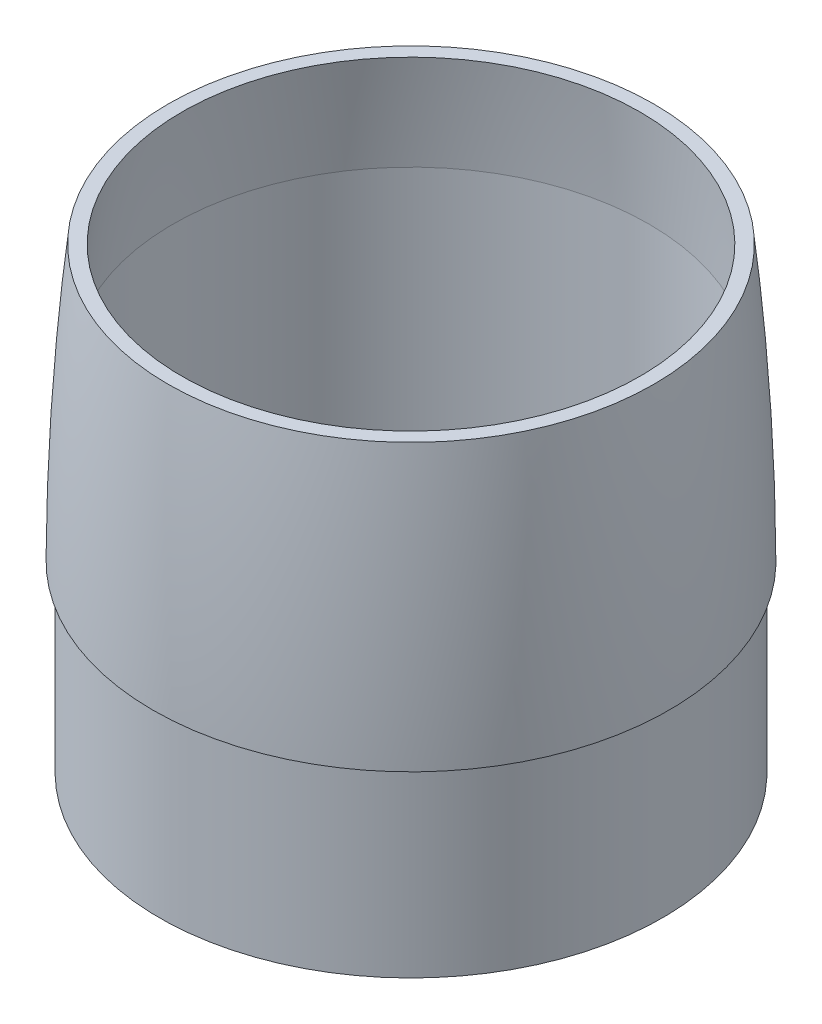
from build123d import *

# Parameters (mm, degrees)
CORTAR_EXTRUIR1_DEPTH      = 301.768881503
CORTAR_EXTRUIR1_DEPTH_BACK = 301.768881503
CROQUIS2_W                 = 123.052160051
CROQUIS2_H                 = 221.260981795


with BuildPart() as part:
    # Croquis1 → Revolución1 (revolve)
    with BuildSketch(Plane(origin=(0, 0, 0), x_dir=(0, 0, -1), z_dir=(1, 0, 0))):
        with BuildLine():
            Line((52, 10), (52, 77.802029213))
            ThreePointArc((52, 77.802029213), (35.222542715, 182.66683475), (0, 282.854074446))
            Line((0, 282.854074446), (0, 290))
            ThreePointArc((0, 290), (41.804081284, 168.069080738), (56.4, 40))
            Line((56.4, 40), (55, 40))
            Line((55, 40), (55, 0))
            Line((55, 0), (52, 0))
            Line((52, 0), (0, 0))
            Line((0, 0), (0, 10))
            Line((0, 10), (52, 10))
        make_face()
    revolve(axis=Axis((0, 0, 0), (0, 1, 0)))

    # Croquis2 → Cortar-Extruir1 (cut, two sides: drawn at the far end of the back side and taken through both)
    with BuildSketch(Plane(origin=(0, 0, 0), x_dir=(0, 0, -1), z_dir=(1, 0, 0)).offset(-CORTAR_EXTRUIR1_DEPTH_BACK)):
        with Locations((-0.582265741, 210.630490898)):
            Rectangle(CROQUIS2_W, CROQUIS2_H)
    extrude(amount=CORTAR_EXTRUIR1_DEPTH + CORTAR_EXTRUIR1_DEPTH_BACK, mode=Mode.SUBTRACT)


solid = part.part
